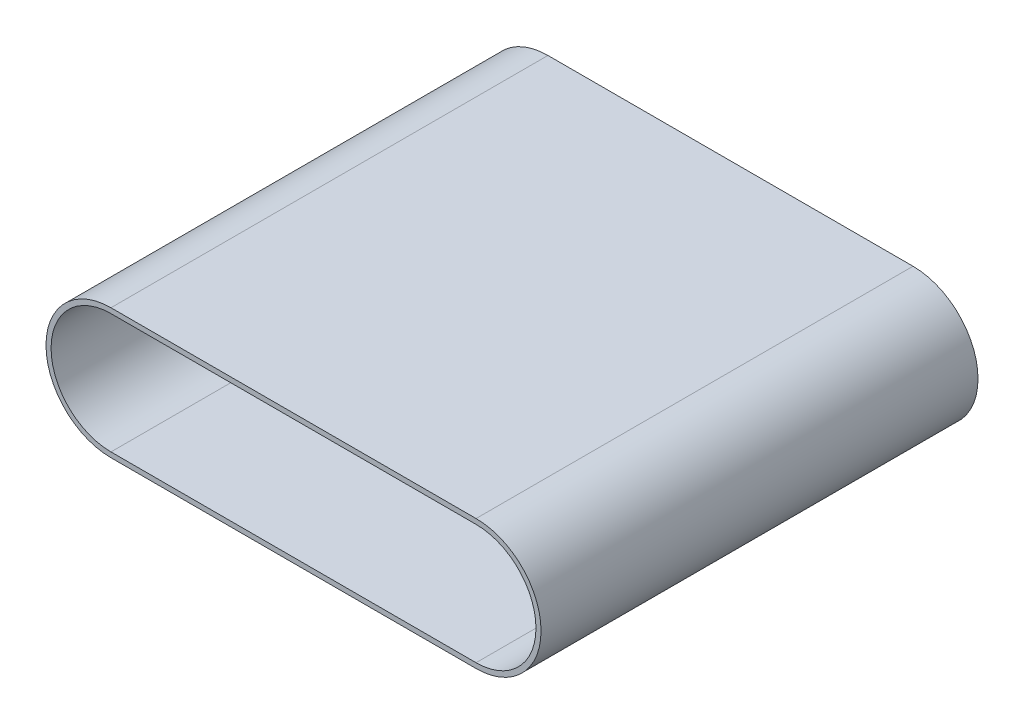
from build123d import *

# Parameters (mm, degrees)
EXTRUDE_THIN1_DEPTH = 65.66


with BuildPart() as part:
    # Sketch1 → Extrude-Thin1 (new body)
    with BuildSketch(Plane.XY):
        with BuildLine():
            Line((54.86, -9.762), (0, -9.762))
            ThreePointArc((0, -9.762), (-9.762, 0), (0, 9.762))
            Line((0, 9.762), (54.86, 9.762))
            ThreePointArc((54.86, 9.762), (64.622, 0), (54.86, -9.762))
        make_face()
        with BuildLine():
            Line((54.86, -9), (0, -9))
            ThreePointArc((0, -9), (-9, 0), (0, 9))
            Line((0, 9), (54.86, 9))
            ThreePointArc((54.86, 9), (63.86, 0), (54.86, -9))
        make_face(mode=Mode.SUBTRACT)
    extrude(amount=EXTRUDE_THIN1_DEPTH)


solid = part.part
